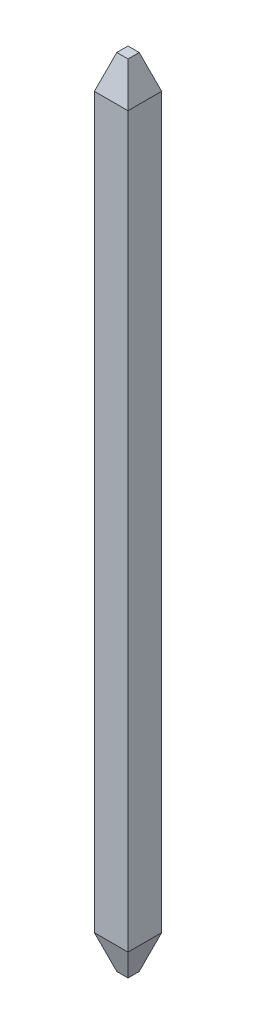
from build123d import *
from OCP.BRepFilletAPI import BRepFilletAPI_MakeChamfer

# Parameters (mm, degrees)
SKIZZE1_W                       = 0.6
SKIZZE1_H                       = 0.6
AUFSATZ_LINEAR_AUSTRAGEN1_DEPTH = 14.2
FASE1_SIZE                      = 0.6
FASE1_SIZE2                     = 0.2
FASE2_SIZE                      = 0.2
FASE2_SIZE2                     = 0.6


with BuildPart() as part:
    # Skizze1 → Aufsatz-Linear austragen1 (new body)
    with BuildSketch(Plane(origin=(0, 0, 0), x_dir=(1, 0, 0), z_dir=(0, 1, 0))):
        Rectangle(SKIZZE1_W, SKIZZE1_H)
    extrude(amount=AUFSATZ_LINEAR_AUSTRAGEN1_DEPTH)

    # Fase1: one chamfer whose edges measure the first distance from different faces: ONE call of the kernel's chamfer builder (chamfer() names one face for all edges)
    fase1_edges_1 = [part.edges().sort_by_distance(p)[0] for p in [
        (-0.3, 14.2, 0),
    ]]
    fase1_side_1 = [part.faces().sort_by_distance(p)[0] for p in [
        (-0.3, 7.1, 0),
    ]]
    fase1_edges_2 = [part.edges().sort_by_distance(p)[0] for p in [
        (0, 14.2, 0.3),
    ]]
    fase1_side_2 = [part.faces().sort_by_distance(p)[0] for p in [
        (0, 7.1, 0.3),
    ]]
    fase1_edges_3 = [part.edges().sort_by_distance(p)[0] for p in [
        (0.3, 14.2, 0),
    ]]
    fase1_side_3 = [part.faces().sort_by_distance(p)[0] for p in [
        (0.3, 7.1, 0),
    ]]
    fase1_edges_4 = [part.edges().sort_by_distance(p)[0] for p in [
        (0, 14.2, -0.3),
    ]]
    fase1_side_4 = [part.faces().sort_by_distance(p)[0] for p in [
        (0, 7.1, -0.3),
    ]]
    fase1 = BRepFilletAPI_MakeChamfer(part.part.solid().wrapped)
    for e in fase1_edges_1:
        fase1.Add(FASE1_SIZE, FASE1_SIZE2, e.wrapped, fase1_side_1[0].wrapped)  # the first distance lies on this face
    for e in fase1_edges_2:
        fase1.Add(FASE1_SIZE, FASE1_SIZE2, e.wrapped, fase1_side_2[0].wrapped)  # the first distance lies on this face
    for e in fase1_edges_3:
        fase1.Add(FASE1_SIZE, FASE1_SIZE2, e.wrapped, fase1_side_3[0].wrapped)  # the first distance lies on this face
    for e in fase1_edges_4:
        fase1.Add(FASE1_SIZE, FASE1_SIZE2, e.wrapped, fase1_side_4[0].wrapped)  # the first distance lies on this face
    add(Compound.cast(fase1.Shape()), mode=Mode.REPLACE)

    # Fase2
    fase2_edges = [part.edges().sort_by_distance(p)[0] for p in [
        (0, 0, 0.3),
        (-0.3, 0, 0),
        (0, 0, -0.3),
        (0.3, 0, 0),
    ]]
    fase2_side = [part.faces().sort_by_distance(p)[0] for p in [
        (0, 0, 0),
    ]]
    chamfer(fase2_edges, length=FASE2_SIZE, length2=FASE2_SIZE2, reference=fase2_side[0])


solid = part.part
